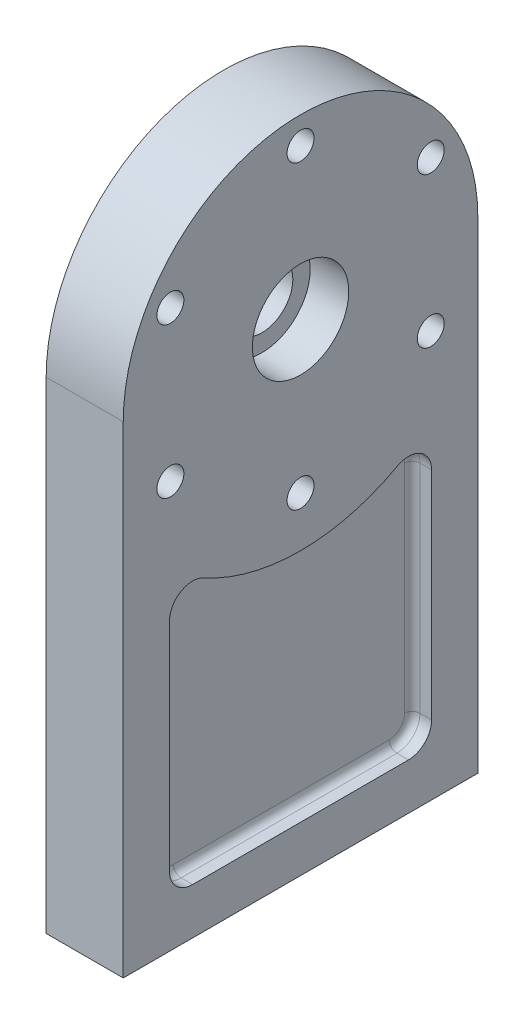
from build123d import *

# Parameters (mm, degrees)
SKETCH1_R            = 3.5
SKETCH1_R_2          = 8
BOSS_EXTRUDE1_DEPTH  = 10
CUT_EXTRUDE1_DEPTH   = 5
FILLET1_R            = 2
SKETCH3_R            = 12.5
CUT_EXTRUDE2_DEPTH   = 10
FILLET1_OF_MIRROR1_R = 2
SKETCH6_R            = 3
CUT_EXTRUDE3_DEPTH   = 10


with BuildPart() as part:
    # Sketch1 → Boss-Extrude1 (new, symmetric)
    # profile 1 of 2: a face of its own
    with BuildSketch(Plane(origin=(0, 0, 0), x_dir=(0, 0, -1), z_dir=(1, 0, 0))):
        with BuildLine():
            ThreePointArc((-46, 62.5), (0, 108.5), (46, 62.5))
            Line((46, 62.5), (46, -62.5))
            Line((46, -62.5), (-46, -62.5))
            Line((-46, -62.5), (-46, 62.5))
        make_face()
        with Locations((-33.774990748, 82)):
            Circle(SKETCH1_R, mode=Mode.SUBTRACT)
        with Locations((-33.774990748, 43)):
            Circle(SKETCH1_R, mode=Mode.SUBTRACT)
        with Locations((0, 23.5)):
            Circle(SKETCH1_R, mode=Mode.SUBTRACT)
        with Locations((33.774990748, 43)):
            Circle(SKETCH1_R, mode=Mode.SUBTRACT)
        with Locations((33.774990748, 82)):
            Circle(SKETCH1_R, mode=Mode.SUBTRACT)
        with Locations((0, 62.5)):
            Circle(SKETCH1_R_2, mode=Mode.SUBTRACT)
        with Locations((0, 101.5)):
            Circle(SKETCH1_R, mode=Mode.SUBTRACT)
        with BuildLine():
            ThreePointArc((-25.103448276, 16.960820334), (-31.051285766, 16.872502771), (-34, 11.706299603))
            Line((-34, 11.706299603), (-34, -44.5))
            ThreePointArc((-34, -44.5), (-32.242640687, -48.742640687), (-28, -50.5))
            Line((-28, -50.5), (28, -50.5))
            ThreePointArc((28, -50.5), (32.242640687, -48.742640687), (34, -44.5))
            Line((34, -44.5), (34, 11.706299603))
            ThreePointArc((34, 11.706299603), (31.051285766, 16.872502771), (25.103448276, 16.960820334))
            ThreePointArc((25.103448276, 16.960820334), (0, 10.5), (-25.103448276, 16.960820334))
        make_face(mode=Mode.SUBTRACT)
    # profile 2 of 2: a face of its own
    with BuildSketch(Plane(origin=(0, 0, 0), x_dir=(0, 0, -1), z_dir=(1, 0, 0))):
        with BuildLine():
            ThreePointArc((-25.103448276, 16.960820334), (0, 10.5), (25.103448276, 16.960820334))
            ThreePointArc((25.103448276, 16.960820334), (31.051285766, 16.872502771), (34, 11.706299603))
            Line((34, 11.706299603), (34, -44.5))
            ThreePointArc((34, -44.5), (32.242640687, -48.742640687), (28, -50.5))
            Line((28, -50.5), (-28, -50.5))
            ThreePointArc((-28, -50.5), (-32.242640687, -48.742640687), (-34, -44.5))
            Line((-34, -44.5), (-34, 11.706299603))
            ThreePointArc((-34, 11.706299603), (-31.051285766, 16.872502771), (-25.103448276, 16.960820334))
        make_face()
    extrude(amount=BOSS_EXTRUDE1_DEPTH, both=True)

    # Sketch2 → Cut-Extrude1 (cut)
    with BuildSketch(Plane(origin=(10, 0, 0), x_dir=(0, 0, -1), z_dir=(1, 0, 0))):
        with BuildLine():
            ThreePointArc((-25.103448276, 16.960820334), (0, 10.5), (25.103448276, 16.960820334))
            ThreePointArc((25.103448276, 16.960820334), (31.051285766, 16.872502771), (34, 11.706299603))
            Line((34, 11.706299603), (34, -44.5))
            ThreePointArc((34, -44.5), (32.242640687, -48.742640687), (28, -50.5))
            Line((28, -50.5), (-28, -50.5))
            ThreePointArc((-28, -50.5), (-32.242640687, -48.742640687), (-34, -44.5))
            Line((-34, -44.5), (-34, 11.706299603))
            ThreePointArc((-34, 11.706299603), (-31.051285766, 16.872502771), (-25.103448276, 16.960820334))
        make_face()
    cut_extrude1 = extrude(amount=-CUT_EXTRUDE1_DEPTH, mode=Mode.SUBTRACT)

    # Fillet1
    fillet1_edges = [part.edges().sort_by_distance(p)[0] for p in [
        (5, -16.396850198, -34),
        (5, 16.872502771, 31.051285766),
        (5, 10.5, 0),
        (5, 16.872502771, -31.051285766),
        (5, -48.742640687, -32.242640687),
        (5, -50.5, 0),
        (5, -48.742640687, 32.242640687),
        (5, -16.396850198, 34),
    ]]
    fillet(fillet1_edges, radius=FILLET1_R)

    # Sketch3 → Cut-Extrude2 (cut)
    with BuildSketch(Plane(origin=(10, 0, 0), x_dir=(0, 0, -1), z_dir=(1, 0, 0))):
        with Locations((0, 62.5)):
            Circle(SKETCH3_R)
    extrude(amount=-CUT_EXTRUDE2_DEPTH, mode=Mode.SUBTRACT)

    # Mirror1: Cut-Extrude1 across plane
    add(cut_extrude1.mirror(Plane(origin=(0, 0, 0), x_dir=(0, 0, 1), z_dir=(1, 0, 0))), mode=Mode.SUBTRACT)

    # Fillet1 of Mirror1
    fillet1_of_mirror1_edges = [part.edges().sort_by_distance(p)[0] for p in [
        (-5, -16.396850198, -34),
        (-5, 16.872502771, 31.051285766),
        (-5, 10.5, 0),
        (-5, 16.872502771, -31.051285766),
        (-5, -48.742640687, -32.242640687),
        (-5, -50.5, 0),
        (-5, -48.742640687, 32.242640687),
        (-5, -16.396850198, 34),
    ]]
    fillet(fillet1_of_mirror1_edges, radius=FILLET1_OF_MIRROR1_R)

    # Sketch6 → Cut-Extrude3 (cut)
    with BuildSketch(Plane.XZ.offset(62.5)):
        with Locations(Location((0, 30, 0), (0, 0, 270))):
            Circle(SKETCH6_R)
        with Locations(Location((0, -30, 0), (0, 0, 270))):
            Circle(SKETCH6_R)
    extrude(amount=-CUT_EXTRUDE3_DEPTH, mode=Mode.SUBTRACT)


solid = part.part
